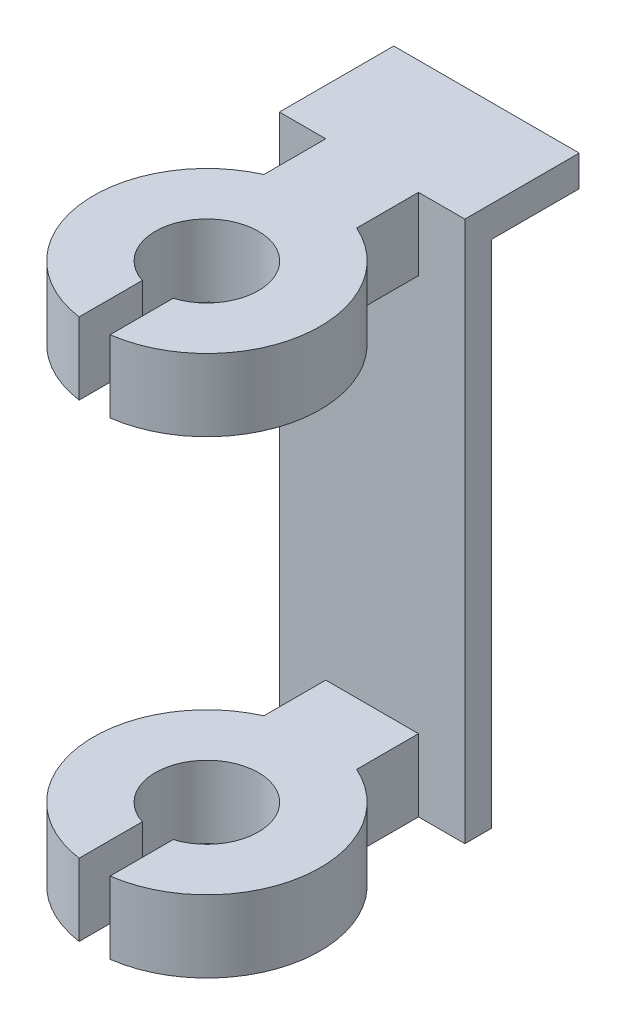
from build123d import *

# Parameters (mm, degrees)
BOSS_EXTRUDE1_DEPTH = 7
SKETCH2_W           = 18
SKETCH2_H           = 2.6
BOSS_EXTRUDE2_DEPTH = 45.5
SKETCH3_W           = 18
SKETCH3_H           = 3
BOSS_EXTRUDE3_DEPTH = 8.5
BOSS_EXTRUDE4_DEPTH = 7
CUT_EXTRUDE1_DEPTH  = 1


with BuildPart() as part:
    # Sketch1 → Boss-Extrude1 (new body)
    with BuildSketch(Plane(origin=(0, 0, 0), x_dir=(1, 0, 0), z_dir=(0, 1, 0))):
        with BuildLine():
            Line((4.5, 10.03742995), (4.5, 16.03742995))
            Line((4.5, 16.03742995), (9, 16.03742995))
            Line((9, 16.03742995), (9, 18.63742995))
            Line((9, 18.63742995), (0, 18.63742995))
            Line((0, 18.63742995), (-9, 18.63742995))
            Line((-9, 18.63742995), (-9, 16.03742995))
            Line((-9, 16.03742995), (-4.5, 16.03742995))
            Line((-4.5, 16.03742995), (-4.5, 10.03742995))
            ThreePointArc((-4.5, 10.03742995), (-10.888763865, -1.560391455), (-1.5, -10.897247359))
            Line((-1.5, -10.897247359), (-1.5, -4.769696007))
            ThreePointArc((-1.5, -4.769696007), (0, 5), (1.5, -4.769696007))
            Line((1.5, -4.769696007), (1.5, -10.897247359))
            ThreePointArc((1.5, -10.897247359), (10.888763865, -1.560391455), (4.5, 10.03742995))
        make_face()
    extrude(amount=BOSS_EXTRUDE1_DEPTH)

    # Sketch2 → Boss-Extrude2 (add)
    with BuildSketch(Plane.XZ):
        with Locations((0, -17.33742995)):
            Rectangle(SKETCH2_W, SKETCH2_H)
    extrude(amount=BOSS_EXTRUDE2_DEPTH)

    # Sketch3 → Boss-Extrude3 (add)
    with BuildSketch(Plane(origin=(0, 0, -18.63742995), x_dir=(-1, 0, 0), z_dir=(0, 0, -1))):
        with Locations((0, 5.5)):
            Rectangle(SKETCH3_W, SKETCH3_H)
    extrude(amount=BOSS_EXTRUDE3_DEPTH)

    # Sketch5 → Boss-Extrude4 (add)
    with BuildSketch(Plane.XZ.offset(45.5)):
        with BuildLine():
            Line((0, -16.03742995), (-4.5, -16.03742995))
            Line((-4.5, -16.03742995), (-4.5, -10.03742995))
            ThreePointArc((-4.5, -10.03742995), (-10.888763865, 1.560391455), (-1.5, 10.897247359))
            Line((-1.5, 10.897247359), (-1.5, 4.769696007))
            ThreePointArc((-1.5, 4.769696007), (0, -5), (1.5, 4.769696007))
            Line((1.5, 4.769696007), (1.5, 10.897247359))
            ThreePointArc((1.5, 10.897247359), (10.888763865, 1.560391455), (4.5, -10.03742995))
            Line((4.5, -10.03742995), (4.5, -16.03742995))
            Line((4.5, -16.03742995), (0, -16.03742995))
        make_face()
    extrude(amount=-BOSS_EXTRUDE4_DEPTH)

    # Sketch6 → Cut-Extrude1 (cut)
    # profile 1 of 2: a face of its own
    with BuildSketch(Plane(origin=(0, 0, -18.63742995), x_dir=(-1, 0, 0), z_dir=(0, 0, -1))):
        with BuildLine():
            Line((3.99466984, 2.422761497), (3.680567276, 2.422761497))
            add(Edge.make_bspline(
                [(3.680567276, 2.422761497), (3.682614429, 2.464432384), (3.686634983, 2.546272899), (3.705463272, 2.665596805), (3.732404149, 2.779651604), (3.770495603, 2.887521518), (3.817801881, 2.990160325), (3.874531909, 3.087160341), (3.941725759, 3.17815153), (4.017932493, 3.262290373), (4.100701132, 3.339477944), (4.190007072, 3.406133187), (4.283852099, 3.462450858), (4.381951498, 3.5095321), (4.485412062, 3.544871946), (4.593294919, 3.571093585), (4.706074056, 3.586869931), (4.782914078, 3.588565717), (4.821993558, 3.589428163)],
                knots=[0, 0, 0, 0, 1.10065271, 2.161652631, 3.183658789, 4.190468796, 5.17591951, 6.163126047, 7.15150782, 8.156236427, 9.156009102, 10.134482811, 11.092018607, 12.041330605, 13.001268258, 13.972401359, 14.968799086, 16, 16, 16, 16], degree=3))
            add(Edge.make_bspline(
                [(4.821993558, 3.589428163), (4.860371632, 3.588529707), (4.935783177, 3.586764272), (5.045845191, 3.571603243), (5.150622486, 3.547857651), (5.249910252, 3.514542235), (5.342916317, 3.469757807), (5.430339361, 3.415960269), (5.513220172, 3.353740437), (5.587826956, 3.280486624), (5.656335035, 3.20228424), (5.71543729, 3.118796336), (5.766050454, 3.03256705), (5.808238133, 2.942938849), (5.839294272, 2.84906782), (5.86287248, 2.752320617), (5.876199894, 2.651695806), (5.878245318, 2.583589251), (5.879285225, 2.54896342)],
                knots=[0, 0, 0, 0, 1.111607364, 2.184268762, 3.212621178, 4.221274766, 5.211760367, 6.196651075, 7.1921475, 8.207485113, 9.220403448, 10.201281604, 11.166441695, 12.114753415, 13.065576456, 14.026450734, 14.996634279, 16, 16, 16, 16], degree=3))
            add(Edge.make_bspline(
                [(5.879285225, 2.54896342), (5.877591962, 2.500215585), (5.87423515, 2.403575372), (5.845520774, 2.261560509), (5.800674263, 2.12396709), (5.746676906, 2.013229788), (5.692204462, 1.923996294), (5.643116954, 1.850527589), (5.585652143, 1.771422121), (5.518973645, 1.686944783), (5.444460773, 1.596433878), (5.36143861, 1.499944083), (5.269315128, 1.398472313), (5.204656627, 1.329166711), (5.171152212, 1.293254285)],
                knots=[0, 0, 0, 0, 1.184426356, 2.348067706, 3.509069118, 4.696110526, 5.333549288, 6.050745305, 6.844228056, 7.710549037, 8.667450064, 9.695053472, 10.805634456, 12, 12, 12, 12], degree=3))
            Line((5.171152212, 1.293254285), (4.29545109, 0.358658933))
            Line((4.29545109, 0.358658933), (5.92415702, 0.358658933))
            Line((5.92415702, 0.358658933), (5.92415702, -0.000315426))
            Line((5.92415702, -0.000315426), (3.545951891, -0.000315426))
            Line((3.545951891, -0.000315426), (4.903323686, 1.448202202))
            add(Edge.make_bspline(
                [(4.903323686, 1.448202202), (4.936371573, 1.482700508), (4.9998498, 1.548964695), (5.089632377, 1.645707655), (5.170271365, 1.735457196), (5.242288758, 1.818043744), (5.304122263, 1.894675312), (5.358994495, 1.962870016), (5.402960086, 2.025624466), (5.450675482, 2.09836508), (5.496889463, 2.187177397), (5.536601819, 2.295711086), (5.560816668, 2.407438339), (5.563721503, 2.482940376), (5.565182661, 2.520918548)],
                knots=[0, 0, 0, 0, 1.329631726, 2.553950428, 3.673215718, 4.687767853, 5.603093632, 6.413772471, 7.123043292, 7.734684054, 8.834405432, 9.900288307, 10.943827018, 12, 12, 12, 12], degree=3))
            add(Edge.make_bspline(
                [(5.565182661, 2.520918548), (5.564546918, 2.544799946), (5.563293992, 2.591865597), (5.552236295, 2.660871356), (5.535525789, 2.72743617), (5.511580531, 2.791764789), (5.479973791, 2.853210441), (5.441500411, 2.911847921), (5.397110347, 2.968536886), (5.345759078, 3.021690184), (5.289347558, 3.07037139), (5.229753308, 3.113495475), (5.166703204, 3.149534586), (5.100463082, 3.179078083), (5.031217613, 3.202253464), (4.958832868, 3.218312044), (4.883508851, 3.228394528), (4.832075356, 3.2297587), (4.805867757, 3.230453804)],
                knots=[0, 0, 0, 0, 0.991446411, 1.95395049, 2.89581595, 3.838931463, 4.798493298, 5.75982156, 6.748411868, 7.785213223, 8.824556874, 9.840280684, 10.836137867, 11.835679398, 12.848801643, 13.863922112, 14.911575587, 16, 16, 16, 16], degree=3))
            add(Edge.make_bspline(
                [(4.805867757, 3.230453804), (4.778496924, 3.229738772), (4.724745128, 3.228334567), (4.645826095, 3.218511903), (4.570540317, 3.201566062), (4.498698414, 3.178389388), (4.430178829, 3.148930839), (4.365314784, 3.112239095), (4.304251895, 3.068455601), (4.246875372, 3.018815045), (4.194011393, 2.963547444), (4.147564517, 2.901937481), (4.106980503, 2.835110065), (4.071571269, 2.763245515), (4.042815579, 2.685691735), (4.020842429, 2.60272403), (4.003455582, 2.514702649), (3.997647061, 2.453917564), (3.99466984, 2.422761497)],
                knots=[0, 0, 0, 0, 1.031018746, 2.02475058, 2.990194455, 3.934040569, 4.864654155, 5.795059489, 6.735614925, 7.690564532, 8.649604399, 9.611025574, 10.590972636, 11.591080095, 12.624614302, 13.701020113, 14.821632451, 16, 16, 16, 16], degree=3))
        make_face()
    # profile 2 of 2: a face of its own
    with BuildSketch(Plane(origin=(0, 0, -18.63742995), x_dir=(-1, 0, 0), z_dir=(0, 0, -1))):
        with BuildLine():
            Line((7.001080096, -0.090059016), (6.750078494, 0.084520311))
            Line((6.750078494, 0.084520311), (7.723235545, 1.507096433))
            add(Edge.make_bspline(
                [(7.723235545, 1.507096433), (7.66114481, 1.499503369), (7.538884689, 1.484552204), (7.415747587, 1.48180555), (7.355146603, 1.480453804)],
                knots=[0, 0, 0, 0, 1.015715272, 2, 2, 2, 2], degree=3))
            add(Edge.make_bspline(
                [(7.355146603, 1.480453804), (7.318404555, 1.481394881), (7.246283128, 1.483242132), (7.140251476, 1.49788394), (7.038365915, 1.520434068), (6.940896559, 1.554082823), (6.847477054, 1.595901032), (6.758311341, 1.647758045), (6.67351945, 1.708764337), (6.594012041, 1.778597329), (6.521700302, 1.855275381), (6.457277004, 1.936431024), (6.403735872, 2.023006995), (6.359259287, 2.113237214), (6.325528833, 2.208418565), (6.300966295, 2.307467965), (6.285843941, 2.411079607), (6.284044845, 2.481604738), (6.283131379, 2.517412939)],
                knots=[0, 0, 0, 0, 1.060718605, 2.082097864, 3.085795603, 4.069760067, 5.054557537, 6.03741023, 7.043284206, 8.066802108, 9.088538119, 10.083643548, 11.053783639, 12.022749082, 12.983451788, 13.964007469, 14.966251758, 16, 16, 16, 16], degree=3))
            add(Edge.make_bspline(
                [(6.283131379, 2.517412939), (6.284865813, 2.566381592), (6.288270157, 2.662497123), (6.315668674, 2.802930892), (6.360729013, 2.935717436), (6.42355739, 3.06050763), (6.502692112, 3.175506369), (6.597800702, 3.279114978), (6.708304666, 3.369859832), (6.831686685, 3.447863909), (6.965039706, 3.510598907), (7.104708364, 3.556838207), (7.249622484, 3.584036955), (7.347790154, 3.587622816), (7.397213911, 3.589428163)],
                knots=[0, 0, 0, 0, 1.022988612, 2.007919123, 2.978103895, 3.94594894, 4.918897164, 5.887013414, 6.875921846, 7.89917871, 8.930658928, 9.948724884, 10.967259574, 12, 12, 12, 12], degree=3))
            add(Edge.make_bspline(
                [(7.397213911, 3.589428163), (7.44570233, 3.587598), (7.541510877, 3.583981771), (7.682399884, 3.557497802), (7.8173409, 3.512861129), (7.945585887, 3.451176565), (8.064325299, 3.373855657), (8.171101111, 3.281721134), (8.26347665, 3.174715606), (8.34130053, 3.055427116), (8.403770571, 2.927260135), (8.448842854, 2.793476213), (8.476588493, 2.655037491), (8.48008482, 2.561243017), (8.481849327, 2.51390733)],
                knots=[0, 0, 0, 0, 1.026385292, 2.028040595, 3.023318987, 4.028184125, 5.03290303, 6.015178782, 7.004435299, 8.016004309, 9.023023918, 10.015172535, 10.998308025, 12, 12, 12, 12], degree=3))
            add(Edge.make_bspline(
                [(8.481849327, 2.51390733), (8.480670918, 2.477163563), (8.478280811, 2.402638022), (8.461544503, 2.289407679), (8.433124318, 2.17395645), (8.40087262, 2.076234854), (8.369740452, 1.995526404), (8.34043932, 1.931774824), (8.307927167, 1.864673561), (8.270008401, 1.794926223), (8.229246104, 1.721643688), (8.183186828, 1.645560972), (8.132881256, 1.566575979), (8.097051536, 1.513328891), (8.078704295, 1.486062779)],
                knots=[0, 0, 0, 0, 1.179839688, 2.393009684, 3.667231171, 4.993948276, 5.694988576, 6.444077775, 7.246288328, 8.089075292, 8.993003841, 9.939041771, 10.944649915, 12, 12, 12, 12], degree=3))
            Line((8.078704295, 1.486062779), (7.001080096, -0.090059016))
        make_face()
        with BuildLine():
            add(Edge.make_bspline(
                [(7.413339712, 1.839428163), (7.441173726, 1.840188547), (7.495357089, 1.841668756), (7.574734388, 1.850677998), (7.649658591, 1.866651984), (7.720329841, 1.889571696), (7.787456743, 1.917228365), (7.849973071, 1.952440351), (7.907931146, 1.994456986), (7.961719073, 2.041667001), (8.009483073, 2.094117585), (8.052026104, 2.149014692), (8.088186671, 2.206599302), (8.116749948, 2.267592564), (8.140234524, 2.330509772), (8.156452536, 2.396364128), (8.165436869, 2.464812528), (8.166968444, 2.511311186), (8.167746763, 2.534940984)],
                knots=[0, 0, 0, 0, 1.163407946, 2.26475976, 3.333800367, 4.359385343, 5.366239384, 6.363380779, 7.350133999, 8.353570782, 9.349036268, 10.310270964, 11.253520213, 12.184142, 13.120487599, 14.056272588, 15.012232024, 16, 16, 16, 16], degree=3))
            add(Edge.make_bspline(
                [(8.167746763, 2.534940984), (8.167077094, 2.558580649), (8.165757429, 2.605165509), (8.155170129, 2.673715249), (8.136544906, 2.73940851), (8.111554421, 2.80260494), (8.078634183, 2.862785312), (8.039130698, 2.920705183), (7.992198248, 2.975997311), (7.938195682, 3.027361295), (7.879961129, 3.074709194), (7.817900628, 3.11649527), (7.752525712, 3.151516466), (7.684235223, 3.180415436), (7.612886874, 3.202967212), (7.538522885, 3.219184577), (7.46076748, 3.228156331), (7.407986194, 3.229678226), (7.381088109, 3.230453804)],
                knots=[0, 0, 0, 0, 0.972161553, 1.915763587, 2.844109794, 3.775983486, 4.705125789, 5.659731448, 6.655561913, 7.682237399, 8.721216875, 9.739758359, 10.754845918, 11.767244016, 12.7857855, 13.828538656, 14.893392813, 16, 16, 16, 16], degree=3))
            add(Edge.make_bspline(
                [(7.381088109, 3.230453804), (7.354423956, 3.229676973), (7.302109107, 3.228152835), (7.225044947, 3.21920163), (7.151183779, 3.202858146), (7.080042159, 3.180425882), (7.011753698, 3.151514311), (6.946381866, 3.116493435), (6.884306849, 3.074718813), (6.826128128, 3.02732404), (6.772030206, 2.976236394), (6.725904677, 2.920462965), (6.686310785, 2.862815441), (6.653435782, 2.802596932), (6.628433265, 2.739410647), (6.609811263, 2.67371467), (6.599223098, 2.60516566), (6.597903552, 2.5585807), (6.597233943, 2.534940984)],
                knots=[0, 0, 0, 0, 1.099389452, 2.15699305, 3.192601482, 4.213358962, 5.227959689, 6.245255729, 7.266013209, 8.307253147, 9.336162325, 10.327954924, 11.284637477, 12.215801273, 13.149702402, 14.080068371, 15.025723358, 16, 16, 16, 16], degree=3))
            add(Edge.make_bspline(
                [(6.597233943, 2.534940984), (6.597839869, 2.511292785), (6.599034866, 2.464654209), (6.610562656, 2.396127816), (6.629840935, 2.330439622), (6.655660326, 2.266950915), (6.689661916, 2.206279057), (6.731385764, 2.148711695), (6.78029131, 2.093596245), (6.835724798, 2.041789033), (6.896392959, 1.994236857), (6.961189705, 1.952706475), (7.028999542, 1.917634031), (7.100061173, 1.889492647), (7.173847972, 1.866880984), (7.251023104, 1.850707438), (7.331331341, 1.841755172), (7.385741323, 1.840211275), (7.413339712, 1.839428163)],
                knots=[0, 0, 0, 0, 0.952633368, 1.87876736, 2.791047057, 3.707742249, 4.635551637, 5.587206343, 6.568248508, 7.601284464, 8.641511608, 9.671105535, 10.699146789, 11.713763218, 12.747829548, 13.806491675, 14.887386225, 16, 16, 16, 16], degree=3))
        make_face(mode=Mode.SUBTRACT)
    extrude(amount=-CUT_EXTRUDE1_DEPTH, mode=Mode.SUBTRACT)


solid = part.part
